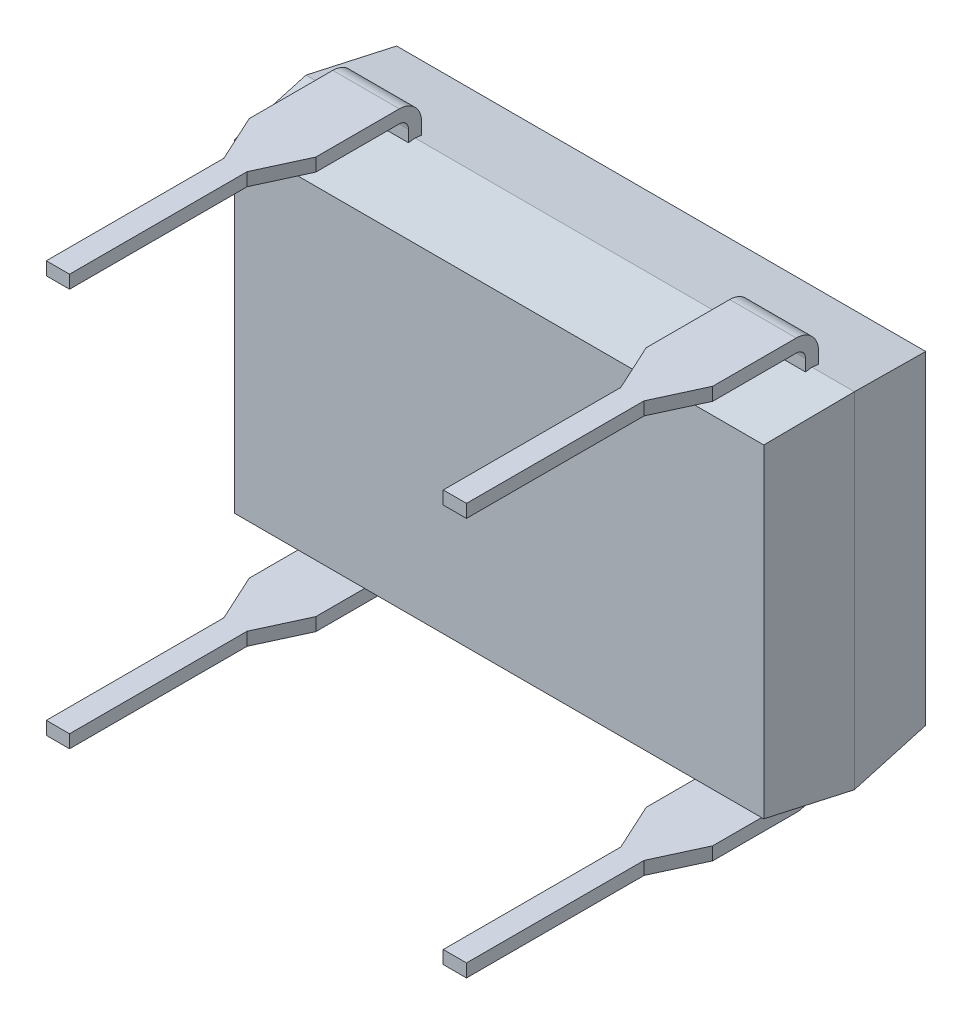
from build123d import *

# Parameters (mm, degrees)
RESSALTO_EXTRUS_O1_DEPTH  = 5.25
CORTE_EXTRUS_O2_DEPTH     = 3.55
ESBO_O8_R                 = 1
CORTE_EXTRUS_O5_DEPTH     = 1.55
ESBO_O6_W                 = 1.275
ESBO_O6_H                 = 0.25
RESSALTO_EXTRUS_O2_DEPTH  = 0.025
ESBO_O7_W                 = 1.275
ESBO_O7_H                 = 0.25
CORTE_EXTRUS_O6_START     = -0.25
CORTE_EXTRUS_O6_DEPTH     = 0.25
ESBO_O10_W                = 0.445
ESBO_O10_H                = 0.25
RESSALTO_EXTRUS_O3_DEPTH  = 3.4
SIMETR_A1_COPY_1_SKETCH_W = 1.275
SIMETR_A1_COPY_1_SKETCH_H = 0.25
SIMETR_A1_COPY_1_DEPTH    = 0.025
SIMETR_A1_COPY_2_SKETCH_W = 1.275
SIMETR_A1_COPY_2_SKETCH_H = 0.25
SIMETR_A1_START           = -0.25
SIMETR_A1_COPY_3_DEPTH    = 0.25
SIMETR_A1_COPY_4_SKETCH_W = 0.445
SIMETR_A1_COPY_4_SKETCH_H = 0.25
SIMETR_A1_COPY_4_DEPTH    = 3.4


with BuildPart() as part:
    # Esboço1 → Ressalto-extrusão1 (new, symmetric)
    with BuildSketch(Plane(origin=(0, 0, 0), x_dir=(0, 0, -1), z_dir=(1, 0, 0))):
        Polygon((0.9, 3.1), (0.9, -3.1), (2.45, -3.3), (4, -3.1), (4, 3.1), (2.45, 3.3), align=None)
    extrude(amount=RESSALTO_EXTRUS_O1_DEPTH, both=True)

    # Esboço3 → Corte-extrusão2 (cut, symmetric)
    with BuildSketch(Plane(origin=(0, 0, 0), x_dir=(1, 0, 0), z_dir=(0, 1, 0))):
        Polygon((-5.25, 2.45), (-5.019897634, 4.376835982), (-6.186348907, 4.376835982), (-6.186348907, 0.523164018), (-5.019897634, 0.523164018), align=None)
    corte_extrus_o2 = extrude(amount=CORTE_EXTRUS_O2_DEPTH, both=True, mode=Mode.SUBTRACT)

    # Espelhar1: Corte-extrusão2 across plane
    add(corte_extrus_o2.mirror(Plane(origin=(0, 0, 0), x_dir=(0, 0, 1), z_dir=(1, 0, 0))), mode=Mode.SUBTRACT)

    # Esboço8 → Corte-extrusão5 (cut)
    with BuildSketch(Plane(origin=(0, 0, -4), x_dir=(-1, 0, 0), z_dir=(0, 0, -1))):
        with Locations((5.064899312, 0)):
            Circle(ESBO_O8_R)
    extrude(amount=-CORTE_EXTRUS_O5_DEPTH, mode=Mode.SUBTRACT)

    # Esboço6 → Ressalto-extrusão2 (add, symmetric)
    with BuildSketch(Plane(origin=(0, 3.3, 0), x_dir=(1, 0, 0), z_dir=(0, 1, 0))):
        with Locations((-3.8, 2.45)):
            Rectangle(ESBO_O6_W, ESBO_O6_H)
    ressalto_extrus_o2 = extrude(amount=RESSALTO_EXTRUS_O2_DEPTH, both=True)

    # Varredura1: sweep along a curve in space
    with BuildLine() as varredura1_path:
        Line((-3.8, 3.325, -2.45), (-3.8, 3.51, -2.45))
        ThreePointArc((-3.8, 3.51, -2.45), (-3.8, 3.722132034, -2.362132034), (-3.8, 3.81, -2.15))
        Line((-3.8, 3.81, -2.15), (-3.8, 3.81, 0.35))
    # Esboço7 → Varredura1 (sweep)
    with BuildSketch(Plane(origin=(0, 3.325, 0), x_dir=(1, 0, 0), z_dir=(0, 1, 0))):
        with Locations((-3.8, 2.45)):
            Rectangle(ESBO_O7_W, ESBO_O7_H)
    varredura1 = sweep(path=varredura1_path.line)

    # Esboço9 → Corte-extrusão6 (cut)
    with BuildSketch(Plane(origin=(0, 3.935, 0), x_dir=(1, 0, 0), z_dir=(0, 1, 0)).offset(CORTE_EXTRUS_O6_START)):
        Polygon((-4.0225, -0.35), (-4.4375, 0.55), (-4.4375, -0.55), (-3.1625, -0.55), (-3.1625, 0.55), (-3.5775, -0.35), align=None)
    corte_extrus_o6 = extrude(amount=CORTE_EXTRUS_O6_DEPTH, mode=Mode.SUBTRACT)

    # Esboço10 → Ressalto-extrusão3 (add)
    with BuildSketch(Plane.XY.offset(0.35)):
        with Locations((-3.8, 3.81)):
            Rectangle(ESBO_O10_W, ESBO_O10_H)
    ressalto_extrus_o3 = extrude(amount=RESSALTO_EXTRUS_O3_DEPTH)

    # Espelhar2: Ressalto-extrusão2, Varredura1, Corte-extrusão6, Ressalto-extrusão3 across plane
    add(ressalto_extrus_o2.mirror(Plane.ZX))
    add(varredura1.mirror(Plane.ZX))
    add(corte_extrus_o6.mirror(Plane.ZX), mode=Mode.SUBTRACT)
    add(ressalto_extrus_o3.mirror(Plane.ZX))

    # Simetría1: Ressalto-extrusão2, Varredura1, Corte-extrusão6, Ressalto-extrusão3 across plane
    add(ressalto_extrus_o2.mirror(Plane(origin=(0, 0, 0), x_dir=(0, 0, 1), z_dir=(1, 0, 0))))
    add(varredura1.mirror(Plane(origin=(0, 0, 0), x_dir=(0, 0, 1), z_dir=(1, 0, 0))))
    add(corte_extrus_o6.mirror(Plane(origin=(0, 0, 0), x_dir=(0, 0, 1), z_dir=(1, 0, 0))), mode=Mode.SUBTRACT)
    add(ressalto_extrus_o3.mirror(Plane(origin=(0, 0, 0), x_dir=(0, 0, 1), z_dir=(1, 0, 0))))

    # Simetría1 copy 1 sketch → Simetría1 copy 1 (add, symmetric)
    with BuildSketch(Plane(origin=(0, -3.3, 0), x_dir=(-1, 0, 0), z_dir=(0, -1, 0))):
        with Locations((-3.8, 2.45)):
            Rectangle(SIMETR_A1_COPY_1_SKETCH_W, SIMETR_A1_COPY_1_SKETCH_H)
    extrude(amount=SIMETR_A1_COPY_1_DEPTH, both=True)

    # Simetría1 copy 2: sweep along a curve in space
    with BuildLine() as simetr_a1_copy_2_path:
        Line((3.8, -3.325, -2.45), (3.8, -3.51, -2.45))
        ThreePointArc((3.8, -3.51, -2.45), (3.8, -3.722132034, -2.362132034), (3.8, -3.81, -2.15))
        Line((3.8, -3.81, -2.15), (3.8, -3.81, 0.35))
    # Simetría1 copy 2 sketch → Simetría1 copy 2 (sweep)
    with BuildSketch(Plane(origin=(0, -3.325, 0), x_dir=(-1, 0, 0), z_dir=(0, -1, 0))):
        with Locations((-3.8, 2.45)):
            Rectangle(SIMETR_A1_COPY_2_SKETCH_W, SIMETR_A1_COPY_2_SKETCH_H)
    sweep(path=simetr_a1_copy_2_path.line)

    # Simetría1 copy 3 sketch → Simetría1 copy 3 (cut)
    with BuildSketch(Plane(origin=(0, -3.935, 0), x_dir=(-1, 0, 0), z_dir=(0, -1, 0)).offset(SIMETR_A1_START)):
        Polygon((-4.0225, -0.35), (-4.4375, 0.55), (-4.4375, -0.55), (-3.1625, -0.55), (-3.1625, 0.55), (-3.5775, -0.35), align=None)
    extrude(amount=SIMETR_A1_COPY_3_DEPTH, mode=Mode.SUBTRACT)

    # Simetría1 copy 4 sketch → Simetría1 copy 4 (add)
    with BuildSketch(Plane(origin=(0, 0, 0.35), x_dir=(-1, 0, 0), z_dir=(0, 0, 1))):
        with Locations((-3.8, 3.81)):
            Rectangle(SIMETR_A1_COPY_4_SKETCH_W, SIMETR_A1_COPY_4_SKETCH_H)
    extrude(amount=SIMETR_A1_COPY_4_DEPTH)


solid = part.part
